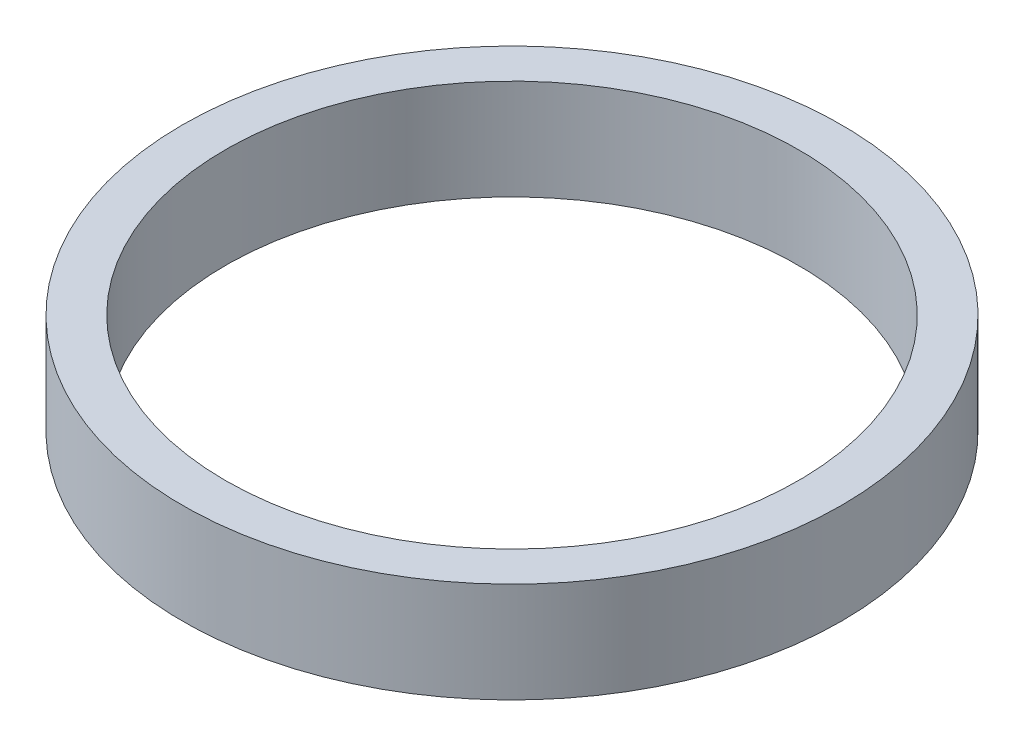
from build123d import *

# Parameters (mm, degrees)
SKETCH1_R           = 11.5
SKETCH1_R_2         = 10
EXTRUDE_THIN1_DEPTH = 3.5


with BuildPart() as part:
    # Sketch1 → Extrude-Thin1 (new body)
    with BuildSketch(Plane(origin=(0, 0, 0), x_dir=(1, 0, 0), z_dir=(0, 1, 0))):
        Circle(SKETCH1_R)
        Circle(SKETCH1_R_2, mode=Mode.SUBTRACT)
    extrude(amount=EXTRUDE_THIN1_DEPTH)


solid = part.part
